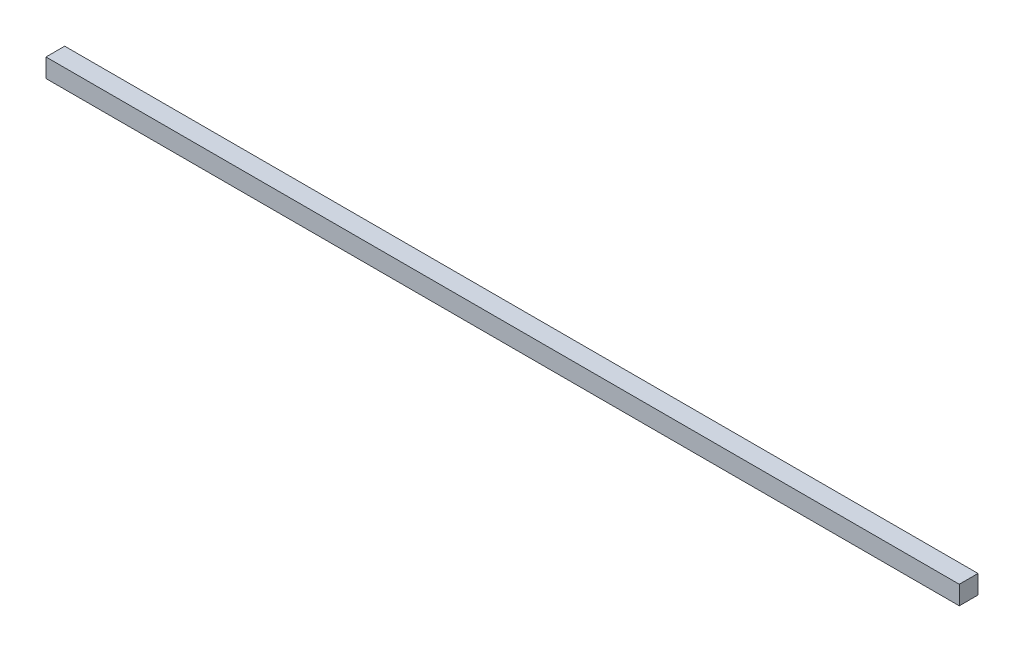
from build123d import *

# Parameters (mm, degrees)
SKETCH_1_W      = 2440
SKETCH_1_H      = 50
EXTRUDE_1_DEPTH = 50


with BuildPart() as part:
    # Эскиз1 → Бобышка-Вытянуть1 (new body)
    with BuildSketch(Plane.XY):
        with Locations((1220, 25)):
            Rectangle(SKETCH_1_W, SKETCH_1_H)
    extrude(amount=EXTRUDE_1_DEPTH)


solid = part.part
